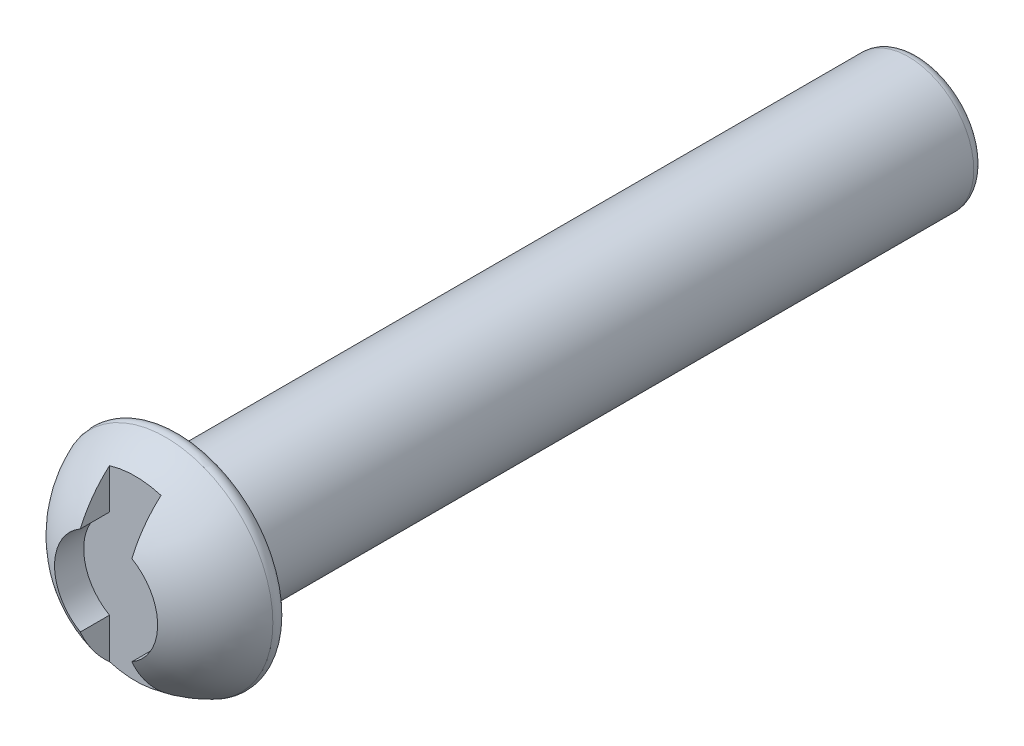
from build123d import *

# Parameters (mm, degrees)
CUT_EXTRUDE1_DEPTH = 0.6
FILLET1_R          = 0.15


with BuildPart() as part:
    # Sketch4 → Revolve2 (revolve)
    with BuildSketch(Plane(origin=(0, 0, 0), x_dir=(0, 0, -1), z_dir=(1, 0, 0))):
        with BuildLine():
            Line((0, 0), (12, 0))
            Line((12, 0), (12, 0.95))
            Line((12, 0.95), (1.25, 0.95))
            Line((1.25, 0.95), (1.25, 1.63))
            ThreePointArc((1.25, 1.63), (0.348475184, 1.027058908), (0, 0))
        make_face()
    revolve(axis=Axis((0, 0, 0), (0, 0, -1)))

    # Sketch5 → Cut-Extrude1 (cut)
    with BuildSketch(Plane.XY):
        with BuildLine():
            Line((-0.375, -0.649519053), (-0.375, -1.87097888))
            Line((-0.375, -1.87097888), (0.375, -1.87097888))
            Line((0.375, -1.87097888), (0.375, -0.649519053))
            ThreePointArc((0.375, -0.649519053), (0.75, 0), (0.375, 0.649519053))
            Line((0.375, 0.649519053), (0.375, 1.87097888))
            Line((0.375, 1.87097888), (-0.375, 1.87097888))
            Line((-0.375, 1.87097888), (-0.375, 0.649519053))
            ThreePointArc((-0.375, 0.649519053), (-0.75, 0), (-0.375, -0.649519053))
        make_face()
    extrude(amount=-CUT_EXTRUDE1_DEPTH, mode=Mode.SUBTRACT)

    # Fillet1
    fillet1_edges = [part.edges().sort_by_distance(p)[0] for p in [
        (0, -1.63, -1.25),
        (0, -0.95, -12),
    ]]
    fillet(fillet1_edges, radius=FILLET1_R)


solid = part.part
